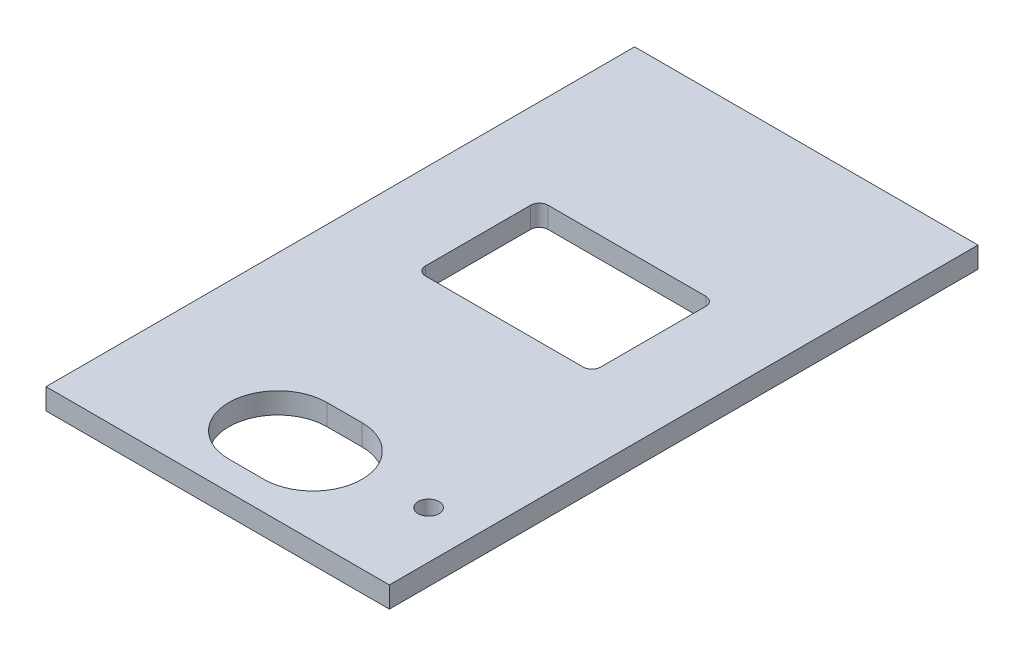
from build123d import *

# Parameters (mm, degrees)
SKETCH1_W           = 196
SKETCH1_H           = 336
BOSS_EXTRUDE2_DEPTH = 12
CUT_EXTRUDE1_DEPTH  = 12
CUT_EXTRUDE2_DEPTH  = 12
SKETCH7_R           = 6
CUT_EXTRUDE3_DEPTH  = 73


with BuildPart() as part:
    # Sketch1 → Boss-Extrude2 (new body)
    with BuildSketch(Plane(origin=(0, 0, 0), x_dir=(1, 0, 0), z_dir=(0, 1, 0))):
        Rectangle(SKETCH1_W, SKETCH1_H)
    extrude(amount=BOSS_EXTRUDE2_DEPTH)

    # Sketch5 → Cut-Extrude1 (cut)
    with BuildSketch(Plane(origin=(0, 12, 0), x_dir=(1, 0, 0), z_dir=(0, 1, 0))):
        with BuildLine():
            Line((10, -151.612579221), (-10, -151.612579221))
            ThreePointArc((-10, -151.612579221), (-38, -123.612579221), (-10, -95.612579221))
            Line((-10, -95.612579221), (10, -95.612579221))
            ThreePointArc((10, -95.612579221), (38, -123.612579221), (10, -151.612579221))
        make_face()
    extrude(amount=-CUT_EXTRUDE1_DEPTH, mode=Mode.SUBTRACT)

    # Sketch6 → Cut-Extrude2 (cut)
    with BuildSketch(Plane(origin=(0, 12, 0), x_dir=(1, 0, 0), z_dir=(0, 1, 0))):
        with BuildLine():
            Line((45.606081406, -5), (-44.393918594, -5))
            ThreePointArc((-44.393918594, -5), (-47.9294525, -3.535533906), (-49.393918594, 0))
            Line((-49.393918594, 0), (-49.393918594, 60))
            ThreePointArc((-49.393918594, 60), (-47.9294525, 63.535533906), (-44.393918594, 65))
            Line((-44.393918594, 65), (45.606081406, 65))
            ThreePointArc((45.606081406, 65), (49.141615312, 63.535533906), (50.606081406, 60))
            Line((50.606081406, 60), (50.606081406, 0))
            ThreePointArc((50.606081406, 0), (49.141615312, -3.535533906), (45.606081406, -5))
        make_face()
    extrude(amount=-CUT_EXTRUDE2_DEPTH, mode=Mode.SUBTRACT)

    # Sketch7 → Cut-Extrude3 (cut)
    with BuildSketch(Plane(origin=(0, 12, 0), x_dir=(1, 0, 0), z_dir=(0, 1, 0))):
        with Locations(Location((71, -118.612579221, 0), (0, 0, 270))):
            Circle(SKETCH7_R)
    extrude(amount=-CUT_EXTRUDE3_DEPTH, mode=Mode.SUBTRACT)


solid = part.part
